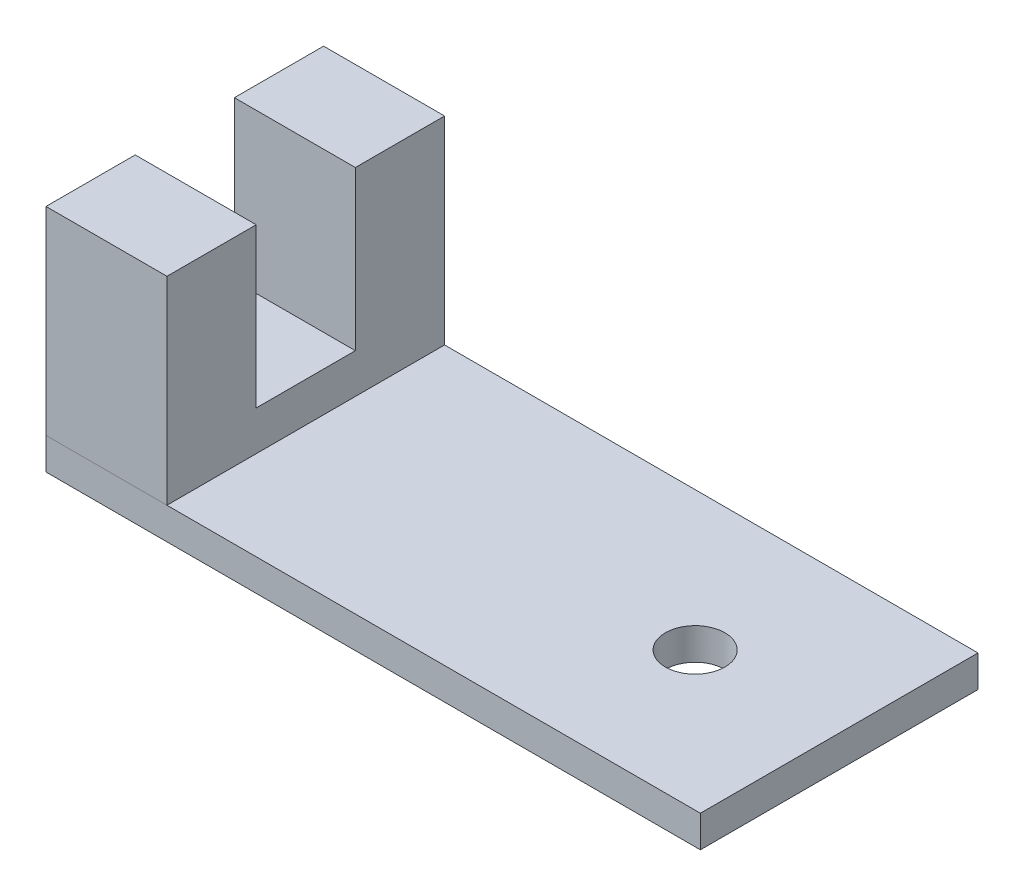
from build123d import *

# Parameters (mm, degrees)
SKETCH1_W           = 33
SKETCH1_H           = 14
BOSS_EXTRUDE1_DEPTH = 1.6
BOSS_EXTRUDE2_DEPTH = 6.1
SKETCH4_R           = 1.5
CUT_EXTRUDE1_DEPTH  = 6.1


with BuildPart() as part:
    # Sketch1 → Boss-Extrude1 (new body)
    with BuildSketch(Plane(origin=(0, 0, 0), x_dir=(1, 0, 0), z_dir=(0, 1, 0))):
        Rectangle(SKETCH1_W, SKETCH1_H)
    extrude(amount=BOSS_EXTRUDE1_DEPTH)

    # Sketch4 → Cut-Extrude1 (cut)
    with BuildSketch(Plane(origin=(0, 1.6, 0), x_dir=(1, 0, 0), z_dir=(0, 1, 0))):
        with Locations(Location((9.235, 0, 0), (0, 0, 270))):
            Circle(SKETCH4_R)
    extrude(amount=-CUT_EXTRUDE1_DEPTH, mode=Mode.SUBTRACT)


with BuildPart() as body_2:
    # Sketch2 → Boss-Extrude2 (new body)
    with BuildSketch(Plane.ZY.offset(16.5)):
        Polygon((-7, 1.6), (-7, 11.6), (-2.5, 11.6), (-2.5, 3.6), (2.5, 3.6), (2.5, 11.6), (7, 11.6), (7, 1.6), align=None)
    extrude(amount=-BOSS_EXTRUDE2_DEPTH)


solid = Compound([part.part, body_2.part])
